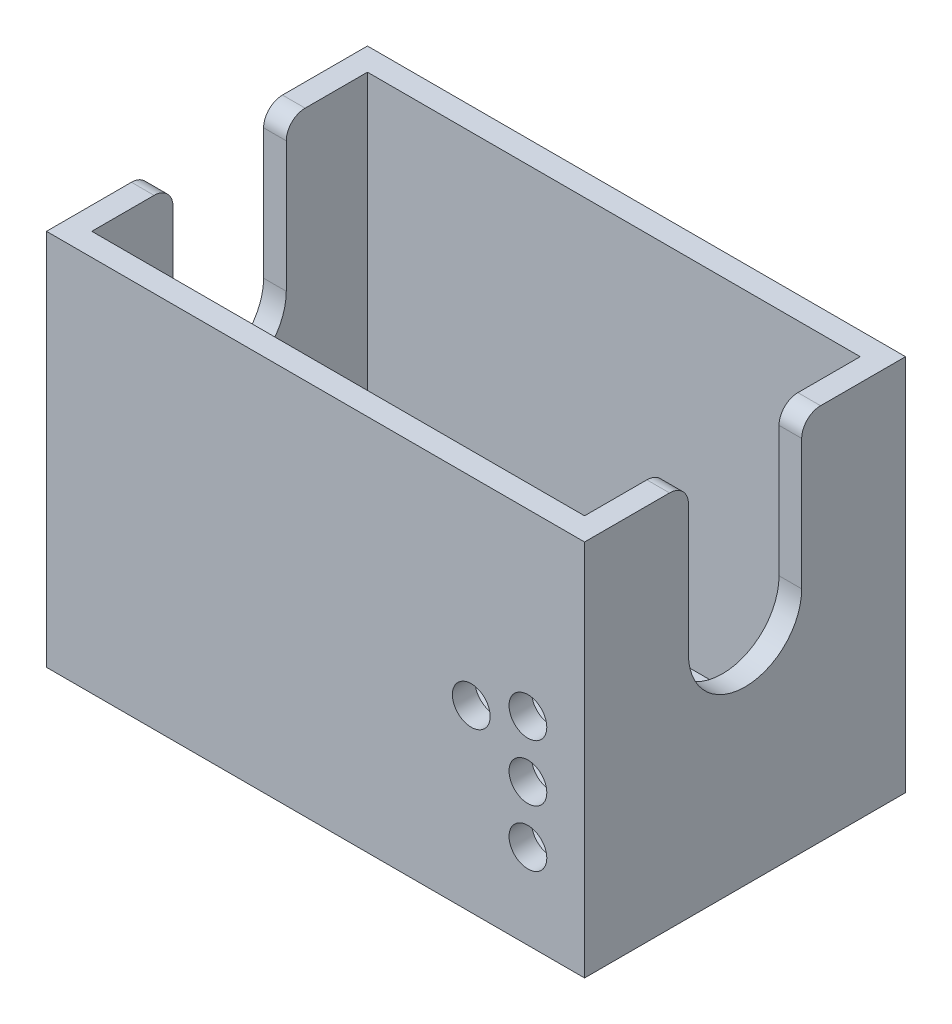
from build123d import *

# Parameters (mm, degrees)
SKETCH1_W               = 285
SKETCH1_H               = 170
BOSS_EXTRUDE1_DEPTH     = 200
SHELL1_T                = -12
CUT_EXTRUDE1_DEPTH      = 359.399218749
CUT_EXTRUDE1_DEPTH_BACK = 359.399218749
SKETCH4_R               = 10
CUT_EXTRUDE2_DEPTH      = 12


with BuildPart() as part:
    # Sketch1 → Boss-Extrude1 (new body)
    with BuildSketch(Plane(origin=(0, 0, 0), x_dir=(1, 0, 0), z_dir=(0, 1, 0))):
        Rectangle(SKETCH1_W, SKETCH1_H)
    extrude(amount=BOSS_EXTRUDE1_DEPTH)

    # Shell1
    shell1_openings = [part.faces().sort_by_distance(p)[0] for p in [
        (0, 200, 0),
    ]]
    offset(amount=SHELL1_T, openings=shell1_openings, kind=Kind.INTERSECTION)

    # Sketch2 → Cut-Extrude1 (cut, two sides: drawn at the far end of the back side and taken through both)
    with BuildSketch(Plane(origin=(142.5, 0, 0), x_dir=(0, 0, -1), z_dir=(1, 0, 0)).offset(-CUT_EXTRUDE1_DEPTH_BACK)):
        with BuildLine():
            Line((-30, 190), (-30, 121))
            ThreePointArc((-30, 121), (0, 91), (30, 121))
            Line((30, 121), (30, 190))
            ThreePointArc((30, 190), (32.928932188, 197.071067812), (40, 200))
            Line((40, 200), (-40, 200))
            ThreePointArc((-40, 200), (-32.928932188, 197.071067812), (-30, 190))
        make_face()
    extrude(amount=CUT_EXTRUDE1_DEPTH + CUT_EXTRUDE1_DEPTH_BACK, mode=Mode.SUBTRACT)

    # Sketch4 → Cut-Extrude2 (cut)
    with BuildSketch(Plane.XY.offset(85)):
        with Locations((112.5, 105)):
            Circle(SKETCH4_R)
        with Locations((112.5, 75)):
            Circle(SKETCH4_R)
        with Locations((112.5, 45)):
            Circle(SKETCH4_R)
        with Locations((82.5, 95)):
            Circle(SKETCH4_R)
    extrude(amount=-CUT_EXTRUDE2_DEPTH, mode=Mode.SUBTRACT)


solid = part.part
